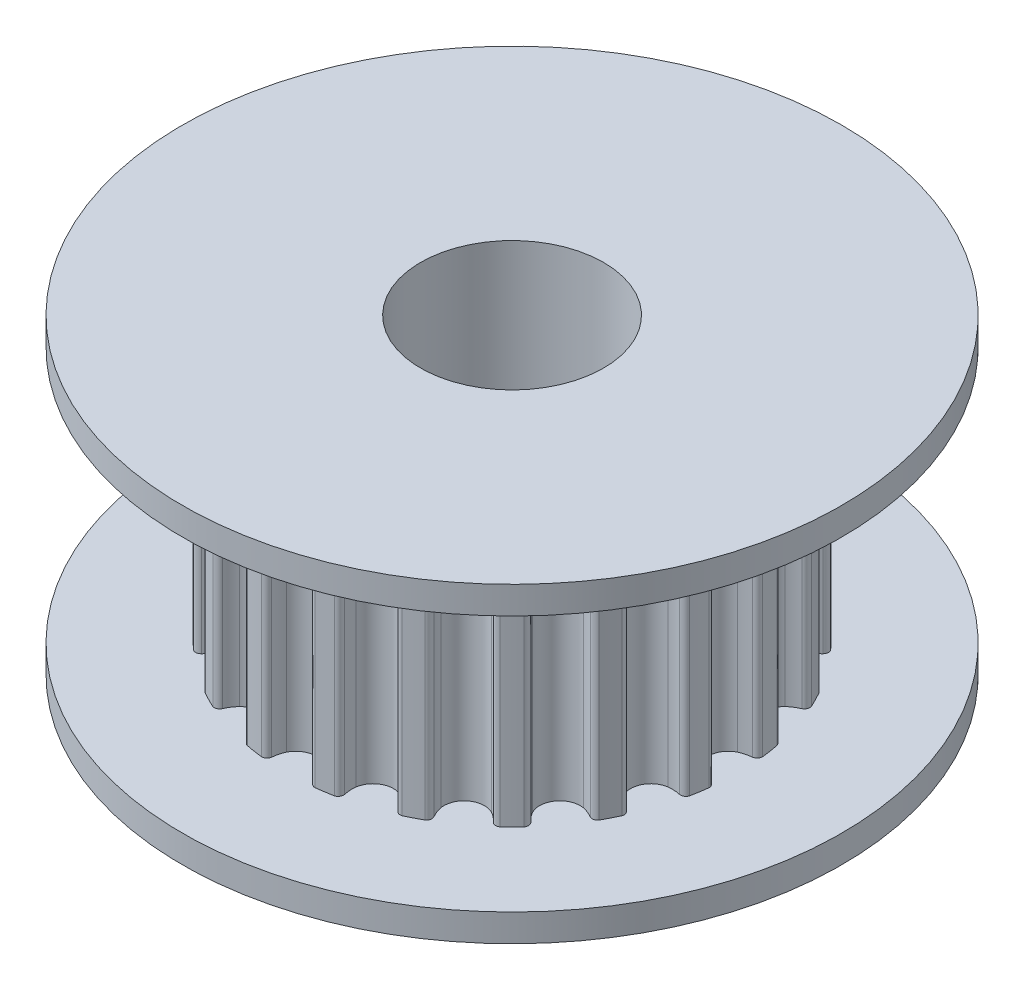
from build123d import *

# Parameters (mm, degrees)
SKETCH2_R           = 6.366203101
SKETCH2_R_2         = 4.366203101
CUT_EXTRUDE1_DEPTH  = 7
SKETCH3_R           = 4.366203101
SKETCH3_R_2         = 1.5
BOSS_EXTRUDE1_DEPTH = 7


with BuildPart() as part:
    # Sketch1 → Revolve1 (revolve)
    with BuildSketch(Plane.XY, mode=Mode.PRIVATE) as revolve1_sk:
        Polygon((2.5, 0), (2.5, 8.5), (9, 8.5), (9, 7.75), (6.366203101, 7.75), (6.366203101, 0.75), (9, 0.75), (9, 0), align=None)
    revolve(revolve1_sk.sketch.rotate(Axis((0, 0, 0), (0, 1, 0)), 90), axis=Axis((0, 0, 0), (0, 1, 0)))

    # Sketch2 → Cut-Extrude1 (cut)
    with BuildSketch(Plane(origin=(0, 0.75, 0), x_dir=(1, 0, 0), z_dir=(0, 1, 0))):
        Circle(SKETCH2_R)
        with Locations(Location((0, 0, 0), (0, 0, 90))):
            Circle(SKETCH2_R_2, mode=Mode.SUBTRACT)
    extrude(amount=CUT_EXTRUDE1_DEPTH, mode=Mode.SUBTRACT)

    # Sketch3 → Boss-Extrude1 (add)
    # profile 1 of 2: a face of its own
    with BuildSketch(Plane(origin=(0, 0.75, 0), x_dir=(1, 0, 0), z_dir=(0, 1, 0))):
        with BuildLine():
            ThreePointArc((6.113457662, -0.730340473), (6.076174412, -0.631371113), (5.98285854, -0.581600411))
            ThreePointArc((5.98285854, -0.581600411), (5.817334791, -0.552657178), (5.658994178, -0.496407091))
            ThreePointArc((5.658994178, -0.496407091), (5.435086525, -0.291780767), (5.352197724, 0))
            ThreePointArc((5.352197724, 0), (5.435086525, 0.291780767), (5.658994178, 0.496407091))
            ThreePointArc((5.658994178, 0.496407091), (5.817334791, 0.552657178), (5.98285854, 0.581600411))
            ThreePointArc((5.98285854, 0.581600411), (6.076174412, 0.631371113), (6.113457662, 0.730340473))
            ThreePointArc((6.113457662, 0.730340473), (6.081158405, 0.96316087), (6.039931364, 1.194567246))
            ThreePointArc((6.039931364, 1.194567246), (5.973889673, 1.277171543), (5.869761011, 1.295670103))
            ThreePointArc((5.869761011, 1.295670103), (5.703394621, 1.272047103), (5.535421516, 1.276614173))
            ThreePointArc((5.535421516, 1.276614173), (5.259239672, 1.402034102), (5.090242522, 1.653920054))
            ThreePointArc((5.090242522, 1.653920054), (5.078909241, 1.957034102), (5.228625062, 2.220836571))
            ThreePointArc((5.228625062, 2.220836571), (5.361833701, 2.323263522), (5.510312189, 2.401939825))
            ThreePointArc((5.510312189, 2.401939825), (5.583680865, 2.478110765), (5.588556129, 2.583757378))
            ThreePointArc((5.588556129, 2.583757378), (5.48589225, 2.795201715), (5.375174502, 3.0025424))
            ThreePointArc((5.375174502, 3.0025424), (5.286838989, 3.06069575), (5.182090378, 3.0461114))
            ThreePointArc((5.182090378, 3.0461114), (5.031166447, 2.972234549), (4.870003228, 2.924671548))
            ThreePointArc((4.870003228, 2.924671548), (4.568581797, 2.958608105), (4.330018916, 3.145942889))
            ThreePointArc((4.330018916, 3.145942889), (4.225572933, 3.430719304), (4.286441694, 3.727875093))
            ThreePointArc((4.286441694, 3.727875093), (4.38147897, 3.866452647), (4.498378089, 3.987160633))
            ThreePointArc((4.498378089, 3.987160633), (4.544617731, 4.08227567), (4.516607784, 4.184258108))
            ThreePointArc((4.516607784, 4.184258108), (4.35362874, 4.35362874), (4.184258108, 4.516607784))
            ThreePointArc((4.184258108, 4.516607784), (4.08227567, 4.544617731), (3.987160633, 4.498378089))
            ThreePointArc((3.987160633, 4.498378089), (3.866452647, 4.38147897), (3.727875093, 4.286441694))
            ThreePointArc((3.727875093, 4.286441694), (3.430719304, 4.225572933), (3.145942889, 4.330018916))
            ThreePointArc((3.145942889, 4.330018916), (2.958608105, 4.568581797), (2.924671548, 4.870003228))
            ThreePointArc((2.924671548, 4.870003228), (2.972234549, 5.031166447), (3.0461114, 5.182090378))
            ThreePointArc((3.0461114, 5.182090378), (3.06069575, 5.286838989), (3.0025424, 5.375174502))
            ThreePointArc((3.0025424, 5.375174502), (2.795201715, 5.48589225), (2.583757378, 5.588556129))
            ThreePointArc((2.583757378, 5.588556129), (2.478110765, 5.583680865), (2.401939825, 5.510312189))
            ThreePointArc((2.401939825, 5.510312189), (2.323263522, 5.361833701), (2.220836571, 5.228625062))
            ThreePointArc((2.220836571, 5.228625062), (1.957034102, 5.078909241), (1.653920054, 5.090242522))
            ThreePointArc((1.653920054, 5.090242522), (1.402034102, 5.259239672), (1.276614173, 5.535421516))
            ThreePointArc((1.276614173, 5.535421516), (1.272047103, 5.703394621), (1.295670103, 5.869761011))
            ThreePointArc((1.295670103, 5.869761011), (1.277171543, 5.973889673), (1.194567246, 6.039931364))
            ThreePointArc((1.194567246, 6.039931364), (0.96316087, 6.081158405), (0.730340473, 6.113457662))
            ThreePointArc((0.730340473, 6.113457662), (0.631371113, 6.076174412), (0.581600411, 5.98285854))
            ThreePointArc((0.581600411, 5.98285854), (0.552657178, 5.817334791), (0.496407091, 5.658994178))
            ThreePointArc((0.496407091, 5.658994178), (0.291780767, 5.435086525), (0, 5.352197724))
            ThreePointArc((0, 5.352197724), (-0.291780767, 5.435086525), (-0.496407091, 5.658994178))
            ThreePointArc((-0.496407091, 5.658994178), (-0.552657178, 5.817334791), (-0.581600411, 5.98285854))
            ThreePointArc((-0.581600411, 5.98285854), (-0.631371113, 6.076174412), (-0.730340473, 6.113457662))
            ThreePointArc((-0.730340473, 6.113457662), (-0.96316087, 6.081158405), (-1.194567246, 6.039931364))
            ThreePointArc((-1.194567246, 6.039931364), (-1.277171543, 5.973889673), (-1.295670103, 5.869761011))
            ThreePointArc((-1.295670103, 5.869761011), (-1.272047103, 5.703394621), (-1.276614173, 5.535421516))
            ThreePointArc((-1.276614173, 5.535421516), (-1.402034102, 5.259239672), (-1.653920054, 5.090242522))
            ThreePointArc((-1.653920054, 5.090242522), (-1.957034102, 5.078909241), (-2.220836571, 5.228625062))
            ThreePointArc((-2.220836571, 5.228625062), (-2.323263522, 5.361833701), (-2.401939825, 5.510312189))
            ThreePointArc((-2.401939825, 5.510312189), (-2.478110765, 5.583680865), (-2.583757378, 5.588556129))
            ThreePointArc((-2.583757378, 5.588556129), (-2.795201715, 5.48589225), (-3.0025424, 5.375174502))
            ThreePointArc((-3.0025424, 5.375174502), (-3.06069575, 5.286838989), (-3.0461114, 5.182090378))
            ThreePointArc((-3.0461114, 5.182090378), (-2.972234549, 5.031166447), (-2.924671548, 4.870003228))
            ThreePointArc((-2.924671548, 4.870003228), (-2.958608105, 4.568581797), (-3.145942889, 4.330018916))
            ThreePointArc((-3.145942889, 4.330018916), (-3.430719304, 4.225572933), (-3.727875093, 4.286441694))
            ThreePointArc((-3.727875093, 4.286441694), (-3.866452647, 4.38147897), (-3.987160633, 4.498378089))
            ThreePointArc((-3.987160633, 4.498378089), (-4.08227567, 4.544617731), (-4.184258108, 4.516607784))
            ThreePointArc((-4.184258108, 4.516607784), (-4.35362874, 4.35362874), (-4.516607784, 4.184258108))
            ThreePointArc((-4.516607784, 4.184258108), (-4.544617731, 4.08227567), (-4.498378089, 3.987160633))
            ThreePointArc((-4.498378089, 3.987160633), (-4.38147897, 3.866452647), (-4.286441694, 3.727875093))
            ThreePointArc((-4.286441694, 3.727875093), (-4.225572933, 3.430719304), (-4.330018916, 3.145942889))
            ThreePointArc((-4.330018916, 3.145942889), (-4.568581797, 2.958608105), (-4.870003228, 2.924671548))
            ThreePointArc((-4.870003228, 2.924671548), (-5.031166447, 2.972234549), (-5.182090378, 3.0461114))
            ThreePointArc((-5.182090378, 3.0461114), (-5.286838989, 3.06069575), (-5.375174502, 3.0025424))
            ThreePointArc((-5.375174502, 3.0025424), (-5.48589225, 2.795201715), (-5.588556129, 2.583757378))
            ThreePointArc((-5.588556129, 2.583757378), (-5.583680865, 2.478110765), (-5.510312189, 2.401939825))
            ThreePointArc((-5.510312189, 2.401939825), (-5.361833701, 2.323263522), (-5.228625062, 2.220836571))
            ThreePointArc((-5.228625062, 2.220836571), (-5.078909241, 1.957034102), (-5.090242522, 1.653920054))
            ThreePointArc((-5.090242522, 1.653920054), (-5.259239672, 1.402034102), (-5.535421516, 1.276614173))
            ThreePointArc((-5.535421516, 1.276614173), (-5.703394621, 1.272047103), (-5.869761011, 1.295670103))
            ThreePointArc((-5.869761011, 1.295670103), (-5.973889673, 1.277171543), (-6.039931364, 1.194567246))
            ThreePointArc((-6.039931364, 1.194567246), (-6.081158405, 0.96316087), (-6.113457662, 0.730340473))
            ThreePointArc((-6.113457662, 0.730340473), (-6.076174412, 0.631371113), (-5.98285854, 0.581600411))
            ThreePointArc((-5.98285854, 0.581600411), (-5.817334791, 0.552657178), (-5.658994178, 0.496407091))
            ThreePointArc((-5.658994178, 0.496407091), (-5.435086525, 0.291780767), (-5.352197724, 0))
            ThreePointArc((-5.352197724, 0), (-5.435086525, -0.291780767), (-5.658994178, -0.496407091))
            ThreePointArc((-5.658994178, -0.496407091), (-5.817334791, -0.552657178), (-5.98285854, -0.581600411))
            ThreePointArc((-5.98285854, -0.581600411), (-6.076174412, -0.631371113), (-6.113457662, -0.730340473))
            ThreePointArc((-6.113457662, -0.730340473), (-6.081158405, -0.96316087), (-6.039931364, -1.194567246))
            ThreePointArc((-6.039931364, -1.194567246), (-5.973889673, -1.277171543), (-5.869761011, -1.295670103))
            ThreePointArc((-5.869761011, -1.295670103), (-5.703394621, -1.272047103), (-5.535421516, -1.276614173))
            ThreePointArc((-5.535421516, -1.276614173), (-5.259239672, -1.402034102), (-5.090242522, -1.653920054))
            ThreePointArc((-5.090242522, -1.653920054), (-5.078909241, -1.957034102), (-5.228625062, -2.220836571))
            ThreePointArc((-5.228625062, -2.220836571), (-5.361833701, -2.323263522), (-5.510312189, -2.401939825))
            ThreePointArc((-5.510312189, -2.401939825), (-5.583680865, -2.478110765), (-5.588556129, -2.583757378))
            ThreePointArc((-5.588556129, -2.583757378), (-5.48589225, -2.795201715), (-5.375174502, -3.0025424))
            ThreePointArc((-5.375174502, -3.0025424), (-5.286838989, -3.06069575), (-5.182090378, -3.0461114))
            ThreePointArc((-5.182090378, -3.0461114), (-5.031166447, -2.972234549), (-4.870003228, -2.924671548))
            ThreePointArc((-4.870003228, -2.924671548), (-4.568581797, -2.958608105), (-4.330018916, -3.145942889))
            ThreePointArc((-4.330018916, -3.145942889), (-4.225572933, -3.430719304), (-4.286441694, -3.727875093))
            ThreePointArc((-4.286441694, -3.727875093), (-4.38147897, -3.866452647), (-4.498378089, -3.987160633))
            ThreePointArc((-4.498378089, -3.987160633), (-4.544617731, -4.08227567), (-4.516607784, -4.184258108))
            ThreePointArc((-4.516607784, -4.184258108), (-4.35362874, -4.35362874), (-4.184258108, -4.516607784))
            ThreePointArc((-4.184258108, -4.516607784), (-4.08227567, -4.544617731), (-3.987160633, -4.498378089))
            ThreePointArc((-3.987160633, -4.498378089), (-3.866452647, -4.38147897), (-3.727875093, -4.286441694))
            ThreePointArc((-3.727875093, -4.286441694), (-3.430719304, -4.225572933), (-3.145942889, -4.330018916))
            ThreePointArc((-3.145942889, -4.330018916), (-2.958608105, -4.568581797), (-2.924671548, -4.870003228))
            ThreePointArc((-2.924671548, -4.870003228), (-2.972234549, -5.031166447), (-3.0461114, -5.182090378))
            ThreePointArc((-3.0461114, -5.182090378), (-3.06069575, -5.286838989), (-3.0025424, -5.375174502))
            ThreePointArc((-3.0025424, -5.375174502), (-2.795201715, -5.48589225), (-2.583757378, -5.588556129))
            ThreePointArc((-2.583757378, -5.588556129), (-2.478110765, -5.583680865), (-2.401939825, -5.510312189))
            ThreePointArc((-2.401939825, -5.510312189), (-2.323263522, -5.361833701), (-2.220836571, -5.228625062))
            ThreePointArc((-2.220836571, -5.228625062), (-1.957034102, -5.078909241), (-1.653920054, -5.090242522))
            ThreePointArc((-1.653920054, -5.090242522), (-1.402034102, -5.259239672), (-1.276614173, -5.535421516))
            ThreePointArc((-1.276614173, -5.535421516), (-1.272047103, -5.703394621), (-1.295670103, -5.869761011))
            ThreePointArc((-1.295670103, -5.869761011), (-1.277171543, -5.973889673), (-1.194567246, -6.039931364))
            ThreePointArc((-1.194567246, -6.039931364), (-0.96316087, -6.081158405), (-0.730340473, -6.113457662))
            ThreePointArc((-0.730340473, -6.113457662), (-0.631371113, -6.076174412), (-0.581600411, -5.98285854))
            ThreePointArc((-0.581600411, -5.98285854), (-0.552657178, -5.817334791), (-0.496407091, -5.658994178))
            ThreePointArc((-0.496407091, -5.658994178), (-0.291780767, -5.435086525), (0, -5.352197724))
            ThreePointArc((0, -5.352197724), (0.291780767, -5.435086525), (0.496407091, -5.658994178))
            ThreePointArc((0.496407091, -5.658994178), (0.552657178, -5.817334791), (0.581600411, -5.98285854))
            ThreePointArc((0.581600411, -5.98285854), (0.631371113, -6.076174412), (0.730340473, -6.113457662))
            ThreePointArc((0.730340473, -6.113457662), (0.96316087, -6.081158405), (1.194567246, -6.039931364))
            ThreePointArc((1.194567246, -6.039931364), (1.277171543, -5.973889673), (1.295670103, -5.869761011))
            ThreePointArc((1.295670103, -5.869761011), (1.272047103, -5.703394621), (1.276614173, -5.535421516))
            ThreePointArc((1.276614173, -5.535421516), (1.402034102, -5.259239672), (1.653920054, -5.090242522))
            ThreePointArc((1.653920054, -5.090242522), (1.957034102, -5.078909241), (2.220836571, -5.228625062))
            ThreePointArc((2.220836571, -5.228625062), (2.323263522, -5.361833701), (2.401939825, -5.510312189))
            ThreePointArc((2.401939825, -5.510312189), (2.478110765, -5.583680865), (2.583757378, -5.588556129))
            ThreePointArc((2.583757378, -5.588556129), (2.795201715, -5.48589225), (3.0025424, -5.375174502))
            ThreePointArc((3.0025424, -5.375174502), (3.06069575, -5.286838989), (3.0461114, -5.182090378))
            ThreePointArc((3.0461114, -5.182090378), (2.972234549, -5.031166447), (2.924671548, -4.870003228))
            ThreePointArc((2.924671548, -4.870003228), (2.958608105, -4.568581797), (3.145942889, -4.330018916))
            ThreePointArc((3.145942889, -4.330018916), (3.430719304, -4.225572933), (3.727875093, -4.286441694))
            ThreePointArc((3.727875093, -4.286441694), (3.866452647, -4.38147897), (3.987160633, -4.498378089))
            ThreePointArc((3.987160633, -4.498378089), (4.08227567, -4.544617731), (4.184258108, -4.516607784))
            ThreePointArc((4.184258108, -4.516607784), (4.35362874, -4.35362874), (4.516607784, -4.184258108))
            ThreePointArc((4.516607784, -4.184258108), (4.544617731, -4.08227567), (4.498378089, -3.987160633))
            ThreePointArc((4.498378089, -3.987160633), (4.38147897, -3.866452647), (4.286441694, -3.727875093))
            ThreePointArc((4.286441694, -3.727875093), (4.225572933, -3.430719304), (4.330018916, -3.145942889))
            ThreePointArc((4.330018916, -3.145942889), (4.568581797, -2.958608105), (4.870003228, -2.924671548))
            ThreePointArc((4.870003228, -2.924671548), (5.031166447, -2.972234549), (5.182090378, -3.0461114))
            ThreePointArc((5.182090378, -3.0461114), (5.286838989, -3.06069575), (5.375174502, -3.0025424))
            ThreePointArc((5.375174502, -3.0025424), (5.48589225, -2.795201715), (5.588556129, -2.583757378))
            ThreePointArc((5.588556129, -2.583757378), (5.583680865, -2.478110765), (5.510312189, -2.401939825))
            ThreePointArc((5.510312189, -2.401939825), (5.361833701, -2.323263522), (5.228625062, -2.220836571))
            ThreePointArc((5.228625062, -2.220836571), (5.078909241, -1.957034102), (5.090242522, -1.653920054))
            ThreePointArc((5.090242522, -1.653920054), (5.259239672, -1.402034102), (5.535421516, -1.276614173))
            ThreePointArc((5.535421516, -1.276614173), (5.703394621, -1.272047103), (5.869761011, -1.295670103))
            ThreePointArc((5.869761011, -1.295670103), (5.973889673, -1.277171543), (6.039931364, -1.194567246))
            ThreePointArc((6.039931364, -1.194567246), (6.081158405, -0.96316087), (6.113457662, -0.730340473))
        make_face()
        Circle(SKETCH3_R, mode=Mode.SUBTRACT)
    # profile 2 of 2: a face of its own
    with BuildSketch(Plane(origin=(0, 0.75, 0), x_dir=(1, 0, 0), z_dir=(0, 1, 0))):
        Circle(SKETCH3_R_2)
    extrude(amount=BOSS_EXTRUDE1_DEPTH)


with BuildPart() as boss_extrude1_kept_piece:
    # of the separate pieces the step leaves, the one the design keeps (boss_extrude1_pieces_kept)
    add(part.part.solids().sort_by_distance((0, 0, -2.5))[0])


solid = boss_extrude1_kept_piece.part
